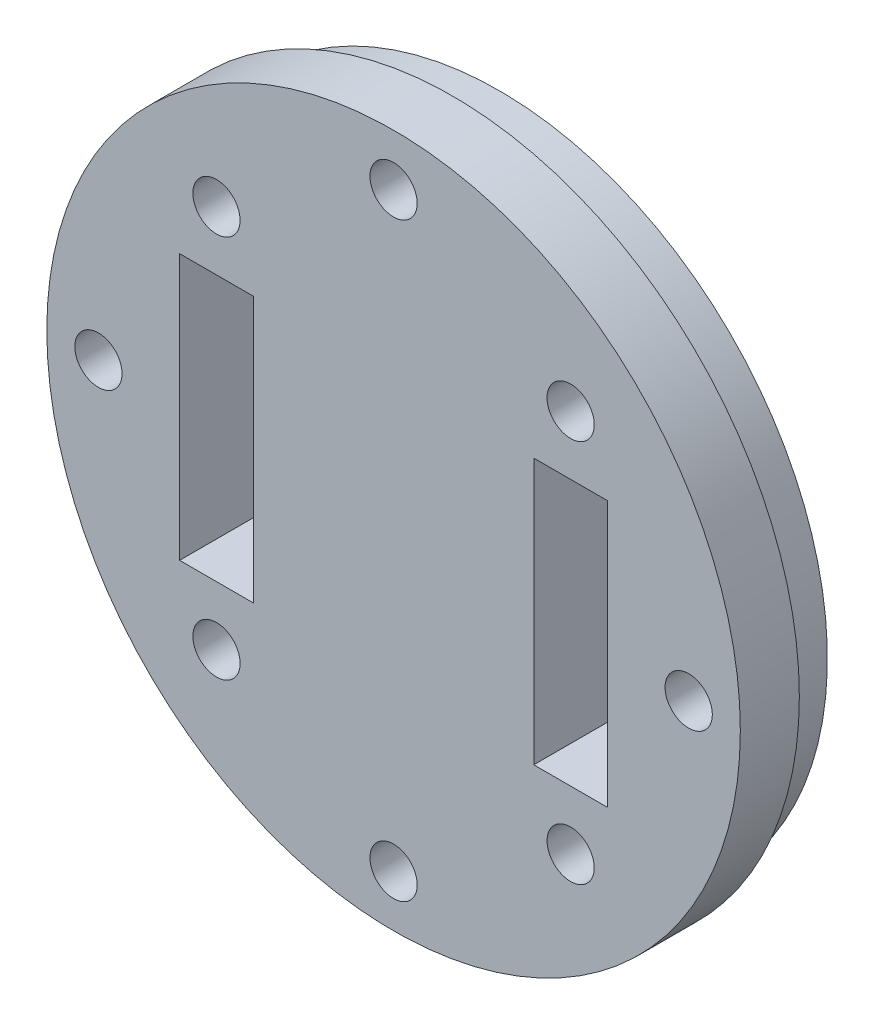
from build123d import *

# Parameters (mm, degrees)
SKETCH_1_R          = 23.5
EXTRUDE_1_DEPTH     = 4
SKETCH_2_R          = 22.225
EXTRUDE_2_DEPTH     = 3.175
SKETCH_3_R          = 1.6
CUT_EXTRUDE_1_DEPTH = 34.999715072
SKETCH_4_W          = 5
SKETCH_4_H          = 18
CUT_EXTRUDE_2_DEPTH = 34.999715072
SKETCH_5_R          = 1.6
CUT_EXTRUDE_3_DEPTH = 34.999715072


with BuildPart() as part:
    # ｽｹｯﾁ1 → ﾎﾞｽ - 押し出し1 (new body)
    with BuildSketch(Plane.XY):
        Circle(SKETCH_1_R)
    extrude(amount=EXTRUDE_1_DEPTH)

    # ｽｹｯﾁ2 → ﾎﾞｽ - 押し出し2 (add)
    with BuildSketch(Plane(origin=(0, 0, 0), x_dir=(-1, 0, 0), z_dir=(0, 0, -1))):
        Circle(SKETCH_2_R)
    extrude(amount=EXTRUDE_2_DEPTH)

    # ｽｹｯﾁ3 → ｶｯﾄ - 押し出し1 (cut, through all)
    with BuildSketch(Plane(origin=(0, 0, -3.175), x_dir=(-1, 0, 0), z_dir=(0, 0, -1))):
        with Locations((0, 20)):
            Circle(SKETCH_3_R)
        with Locations((20, 0)):
            Circle(SKETCH_3_R)
        with Locations((0, -20)):
            Circle(SKETCH_3_R)
        with Locations((-20, 0)):
            Circle(SKETCH_3_R)
    extrude(amount=-CUT_EXTRUDE_1_DEPTH, mode=Mode.SUBTRACT)

    # ｽｹｯﾁ4 → ｶｯﾄ - 押し出し2 (cut, through all)
    with BuildSketch(Plane(origin=(0, 0, -3.175), x_dir=(-1, 0, 0), z_dir=(0, 0, -1))):
        with Locations((12, 0)):
            Rectangle(SKETCH_4_W, SKETCH_4_H)
        with Locations((-12, 0)):
            Rectangle(SKETCH_4_W, SKETCH_4_H)
    extrude(amount=-CUT_EXTRUDE_2_DEPTH, mode=Mode.SUBTRACT)

    # ｽｹｯﾁ5 → ｶｯﾄ - 押し出し3 (cut, through all)
    with BuildSketch(Plane(origin=(0, 0, -3.175), x_dir=(-1, 0, 0), z_dir=(0, 0, -1))):
        with Locations((-12, 13)):
            Circle(SKETCH_5_R)
        with Locations(Location((-12, -13, 0), (0, 0, 180))):
            Circle(SKETCH_5_R)
        with Locations((12, -13)):
            Circle(SKETCH_5_R)
        with Locations(Location((12, 13, 0), (0, 0, 180))):
            Circle(SKETCH_5_R)
    extrude(amount=-CUT_EXTRUDE_3_DEPTH, mode=Mode.SUBTRACT)


solid = part.part
